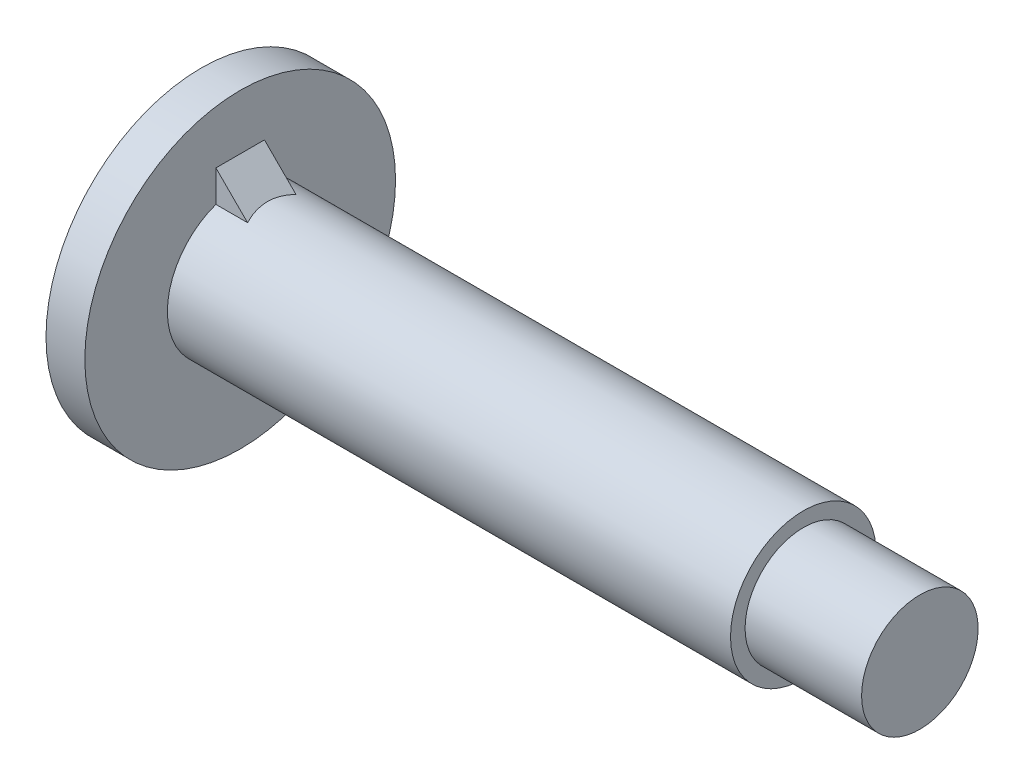
from build123d import *

# Parameters (mm, degrees)
SALIENTE_EXTRUIR1_DEPTH = 1.25


with BuildPart() as part:
    # Croquis1 → Revolución1 (revolve)
    with BuildSketch(Plane.XY, mode=Mode.PRIVATE) as revoluci_n1_sk:
        Polygon((0, 0), (37, 0), (37, 3), (31, 3), (31, 3.75), (2, 3.75), (2, 8), (0, 8), align=None)
    revolve(revoluci_n1_sk.sketch.rotate(Axis((0, 0, 0), (1, 0, 0)), 90), axis=Axis((0, 0, 0), (1, 0, 0)))

    # Croquis2 → Saliente-Extruir1 (add, symmetric)
    with BuildSketch(Plane.XY):
        Polygon((2, 5.164213562), (3.414213562, 3.75), (5.426219931, 1.737993631), (0.712521071, 1.737993631), (0.712521071, 6.451692492), align=None)
    extrude(amount=SALIENTE_EXTRUIR1_DEPTH, both=True)


solid = part.part
